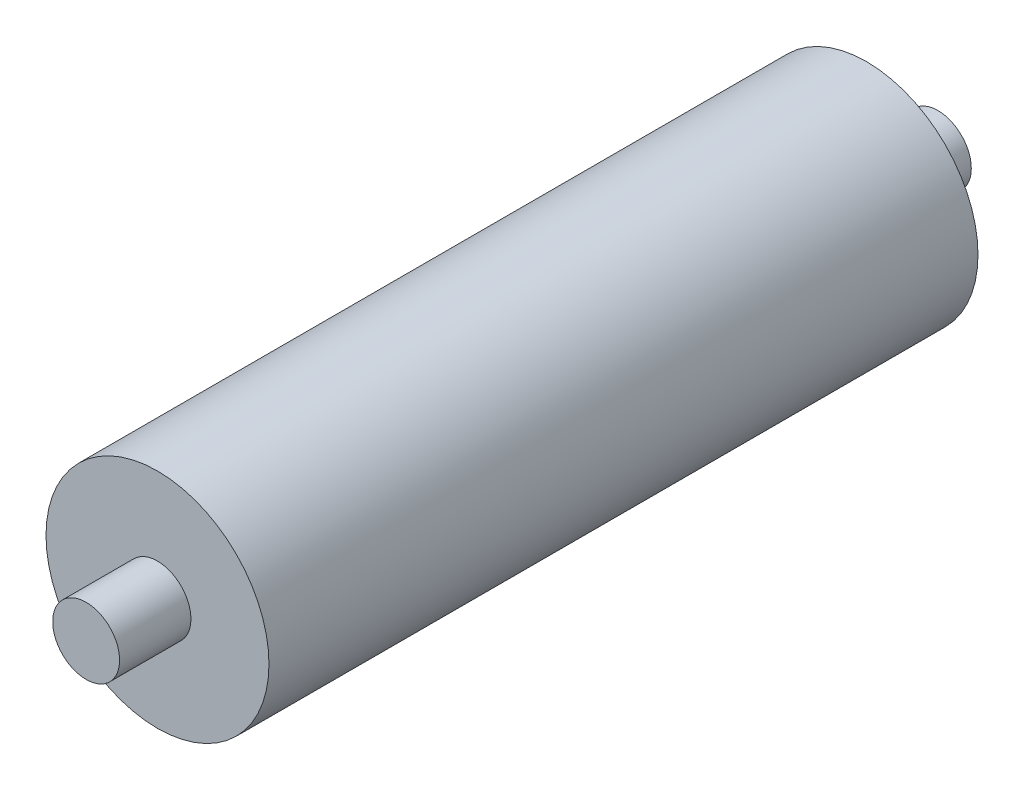
from build123d import *

# Parameters (mm, degrees)
SKETCH1_R           = 50
BOSS_EXTRUDE1_DEPTH = 318
SKETCH2_R           = 15
BOSS_EXTRUDE2_DEPTH = 32


with BuildPart() as part:
    # Sketch1 → Boss-Extrude1 (new body)
    with BuildSketch(Plane.XY):
        with Locations((-8.993956806, 14.489721156)):
            Circle(SKETCH1_R)
    extrude(amount=-BOSS_EXTRUDE1_DEPTH)

    # Sketch2 → Boss-Extrude2 (add)
    with BuildSketch(Plane.XY):
        with Locations((-8.993956806, 14.489721156)):
            Circle(SKETCH2_R)
    boss_extrude2 = extrude(amount=BOSS_EXTRUDE2_DEPTH)

    # Mirror1: Boss-Extrude2 across plane
    add(boss_extrude2.mirror(Plane.XY.offset(-159)))


solid = part.part
